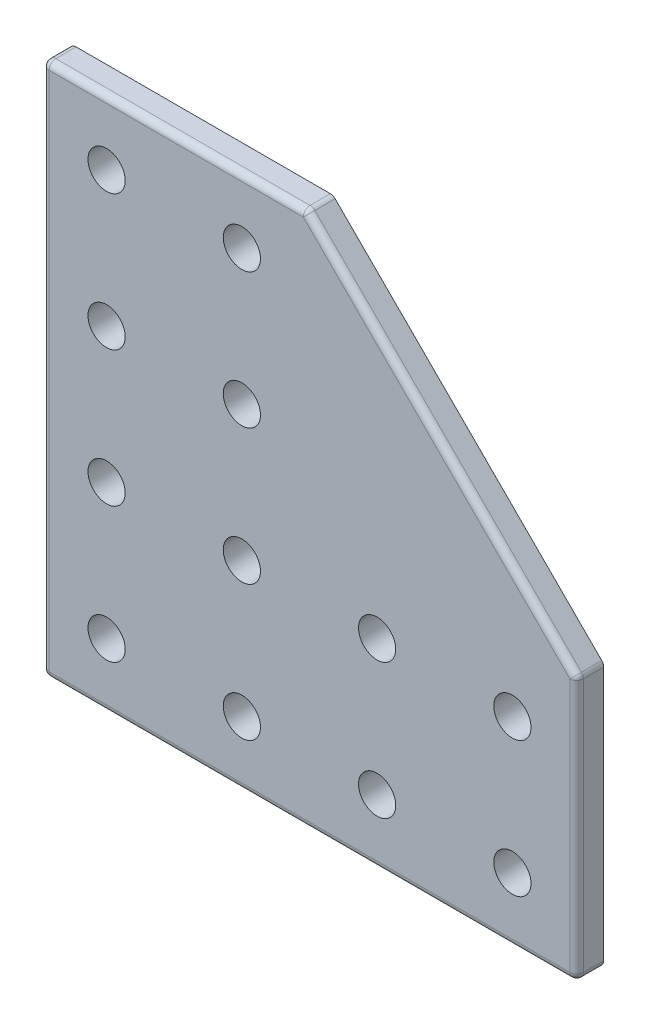
from build123d import *

# Parameters (mm, degrees)
SKETCH1_R           = 2.75
BOSS_EXTRUDE1_DEPTH = 2
FILLET1_R           = 1


with BuildPart() as part:
    # Sketch1 → Boss-Extrude1 (new, symmetric)
    with BuildSketch(Plane.XY):
        Polygon((0, 0), (0, 79), (39, 79), (79, 39), (79, 0), align=None)
        with Locations((9.5, 9.5)):
            Circle(SKETCH1_R, mode=Mode.SUBTRACT)
        with Locations((29.5, 9.5)):
            Circle(SKETCH1_R, mode=Mode.SUBTRACT)
        with Locations((49.5, 9.5)):
            Circle(SKETCH1_R, mode=Mode.SUBTRACT)
        with Locations((9.5, 29.5)):
            Circle(SKETCH1_R, mode=Mode.SUBTRACT)
        with Locations((9.5, 49.5)):
            Circle(SKETCH1_R, mode=Mode.SUBTRACT)
        with Locations((69.5, 9.5)):
            Circle(SKETCH1_R, mode=Mode.SUBTRACT)
        with Locations((69.5, 29.5)):
            Circle(SKETCH1_R, mode=Mode.SUBTRACT)
        with Locations((49.5, 29.5)):
            Circle(SKETCH1_R, mode=Mode.SUBTRACT)
        with Locations((29.5, 29.5)):
            Circle(SKETCH1_R, mode=Mode.SUBTRACT)
        with Locations((29.5, 49.5)):
            Circle(SKETCH1_R, mode=Mode.SUBTRACT)
        with Locations((29.5, 69.5)):
            Circle(SKETCH1_R, mode=Mode.SUBTRACT)
        with Locations((9.5, 69.5)):
            Circle(SKETCH1_R, mode=Mode.SUBTRACT)
    extrude(amount=BOSS_EXTRUDE1_DEPTH, both=True)

    # Fillet1
    fillet1_edges = [part.edges().sort_by_distance(p)[0] for p in [
        (59, 59, 2),
        (19.5, 79, 2),
        (0, 39.5, 2),
        (39.5, 0, 2),
        (79, 19.5, 2),
        (0, 0, 0),
        (0, 79, 0),
        (39, 79, 0),
        (79, 39, 0),
        (79, 0, 0),
    ]]
    fillet(fillet1_edges, radius=FILLET1_R)


solid = part.part
